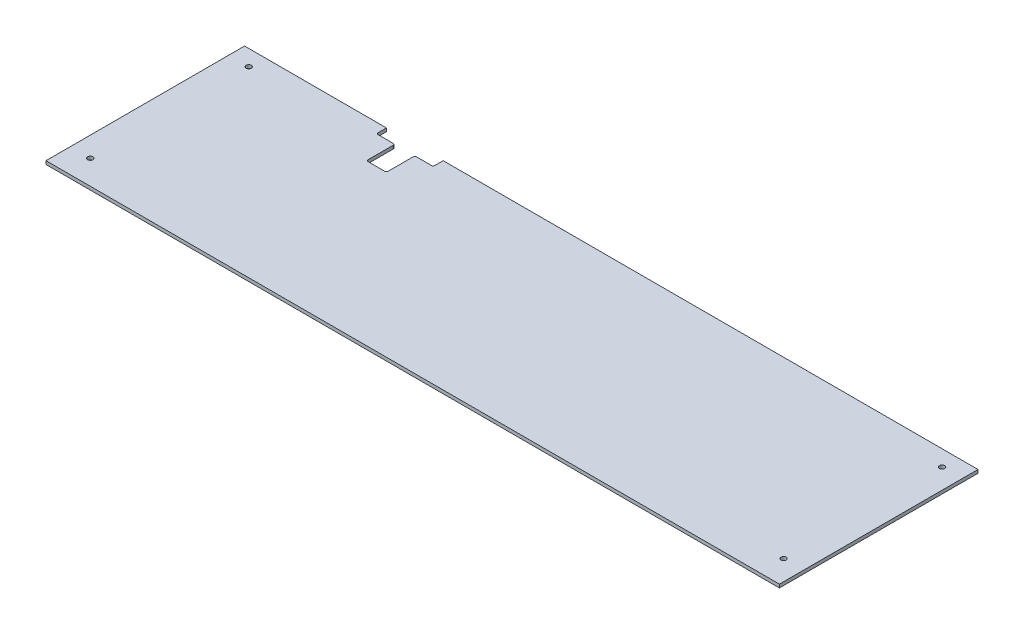
from build123d import *

# Parameters (mm, degrees)
CROQUIS1_W              = 440.5
CROQUIS1_H              = 120
CROQUIS1_R              = 1.55
SALIENTE_EXTRUIR1_DEPTH = 2
CROQUIS2_W              = 440.5
CROQUIS2_H              = 120
CROQUIS2_W_2            = 439.5
CROQUIS2_H_2            = 119
CORTAR_EXTRUIR1_DEPTH   = 2
CORTAR_EXTRUIR2_DEPTH   = 2
REDONDEO1_R             = 1


with BuildPart() as part:
    # Croquis1 → Saliente-Extruir1 (new body)
    with BuildSketch(Plane(origin=(0, 0, 0), x_dir=(1, 0, 0), z_dir=(0, 1, 0))):
        with Locations((220.25, 60)):
            Rectangle(CROQUIS1_W, CROQUIS1_H)
        with Locations(Location((12.5, 15, 0), (0, 0, 270))):
            Circle(CROQUIS1_R, mode=Mode.SUBTRACT)
        with Locations(Location((12.5, 110, 0), (0, 0, 270))):
            Circle(CROQUIS1_R, mode=Mode.SUBTRACT)
        with Locations(Location((428, 15, 0), (0, 0, 90))):
            Circle(CROQUIS1_R, mode=Mode.SUBTRACT)
        with Locations(Location((428, 110, 0), (0, 0, 90))):
            Circle(CROQUIS1_R, mode=Mode.SUBTRACT)
    extrude(amount=SALIENTE_EXTRUIR1_DEPTH)

    # Croquis2 → Cortar-Extruir1 (cut)
    with BuildSketch(Plane.XZ):
        with Locations((220.25, -60)):
            Rectangle(CROQUIS2_W, CROQUIS2_H)
        with Locations((220.25, -60)):
            Rectangle(CROQUIS2_W_2, CROQUIS2_H_2, mode=Mode.SUBTRACT)
    extrude(amount=-CORTAR_EXTRUIR1_DEPTH, mode=Mode.SUBTRACT)

    # Croquis3 → Cortar-Extruir2 (cut)
    with BuildSketch(Plane.XZ):
        Polygon((85.5, -119.5), (119.5, -119.5), (119.5, -113.5), (108.5, -113.5), (108.5, -96.5), (96.5, -96.5), (96.5, -113.5), (85.5, -113.5), align=None)
    extrude(amount=-CORTAR_EXTRUIR2_DEPTH, mode=Mode.SUBTRACT)

    # Redondeo1
    redondeo1_edges = [part.edges().sort_by_distance(p)[0] for p in [
        (85.5, 1, -113.5),
        (96.5, 1, -113.5),
        (96.5, 1, -96.5),
        (108.5, 1, -96.5),
        (108.5, 1, -113.5),
        (119.5, 1, -113.5),
    ]]
    fillet(redondeo1_edges, radius=REDONDEO1_R)


solid = part.part
